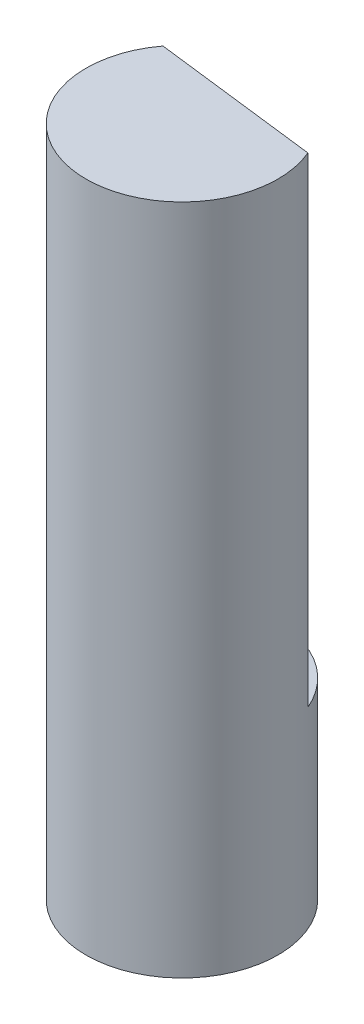
from build123d import *

# Parameters (mm, degrees)
SKETCH1_R           = 2
BOSS_EXTRUDE1_DEPTH = 14
CUT_EXTRUDE1_DEPTH  = 10


with BuildPart() as part:
    # Sketch1 → Boss-Extrude1 (new body)
    with BuildSketch(Plane(origin=(0, 0, 0), x_dir=(1, 0, 0), z_dir=(0, 1, 0))):
        with Locations(Location((0, 0, 0), (0, 0, 270))):
            Circle(SKETCH1_R)
    extrude(amount=BOSS_EXTRUDE1_DEPTH)

    # Sketch2 → Cut-Extrude1 (cut)
    with BuildSketch(Plane(origin=(0, 14, 0), x_dir=(1, 0, 0), z_dir=(0, 1, 0))):
        Polygon((-21.08755408, 3.579527117), (-1.598232712, 1.202352777), (1.840384405, 0.782933741), (21.329705773, -1.594240599), (26.084054454, 37.384402138), (-16.333205399, 42.558169855), align=None)
    extrude(amount=-CUT_EXTRUDE1_DEPTH, mode=Mode.SUBTRACT)


solid = part.part
